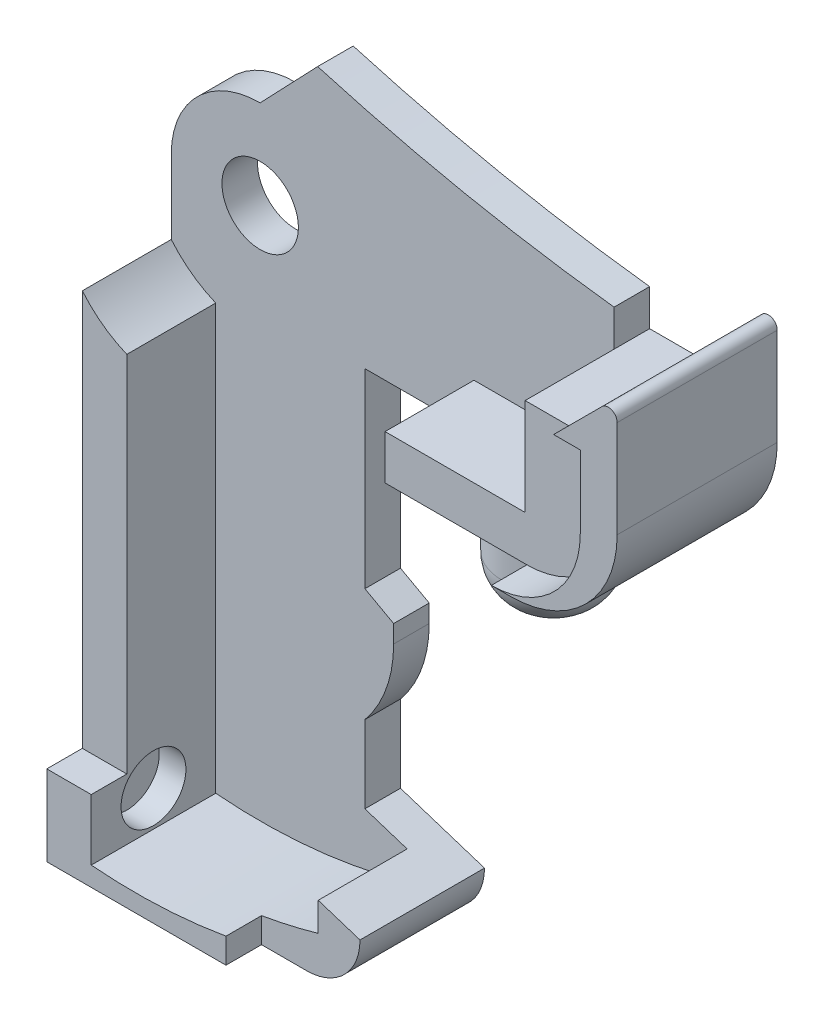
from build123d import *

# Parameters (mm, degrees)
EXTRUDE_3_DEPTH     = 9
EXTRUDE_3_2_DEPTH   = 9
EXTRUDE_4_DEPTH     = 7
SKETCH_1_8_R        = 2.15
EXTRUDE_5_DEPTH     = 2
SKETCH_2_R          = 2.9
EXTRUDE_6_DEPTH     = 2.45
SKETCH_4_R          = 2.9
EXTRUDE_7_DEPTH     = 2
FILLET_2_R          = 2.4
SKETCH_5_R          = 1.825
CUT_EXTRUDE_1_DEPTH = 1.5


with BuildPart() as part:
    # 스케치1 → 보스-돌출3 (new body)
    with BuildSketch(Plane.XY):
        with BuildLine():
            Line((-2.5, -26.437677825), (-5, -26.437677825))
            Line((-5, -26.437677825), (-5, -30.96175738))
            Line((-5, -30.96175738), (5.076141326, -30.96175738))
            Line((5.076141326, -30.96175738), (5.076141326, -29.54601506))
            ThreePointArc((5.076141326, -29.54601506), (1.298498135, -29.950761581), (-2.5, -29.874474333))
            Line((-2.5, -29.874474333), (-2.5, -26.437677825))
        make_face()
    extrude(amount=EXTRUDE_3_DEPTH)

    # 스케치1<7> → 보스-돌출4 (add)
    with BuildSketch(Plane.XY):
        with BuildLine():
            Line((23.5, 2.950728465), (19.9, 2.950728465))
            Line((19.9, 2.950728465), (19.9, -2.499271535))
            Line((19.9, -2.499271535), (12.023157318, -2.499271535))
            Line((12.023157318, -2.499271535), (12.023157318, -5))
            Line((12.023157318, -5), (20, -5))
            ThreePointArc((20, -5), (23.535533906, -3.535533906), (25, 0))
            Line((25, 0), (25, 4.09591659))
            Line((25, 4.09591659), (23.5, 4.09591659))
            Line((23.5, 4.09591659), (23.5, 2.950728465))
        make_face()
        with BuildLine():
            ThreePointArc((-2.5, -6), (-3.862002616, -5.228282299), (-5, -4.153311931))
            Line((-5, -4.153311931), (-5, -26.437677825))
            Line((-5, -26.437677825), (-2.5, -26.437677825))
            Line((-2.5, -26.437677825), (-2.5, -6))
        make_face()
        with BuildLine():
            Line((5.076141326, -29.54601506), (5.076141326, -30.96175738))
            Line((5.076141326, -30.96175738), (7.613716386, -30.96175738))
            ThreePointArc((7.613716386, -30.96175738), (9.735036729, -30.083077723), (10.613716386, -27.96175738))
            Line((10.613716386, -27.96175738), (8.264928228, -27.20398111))
            Line((8.264928228, -27.20398111), (8.264928228, -28.81709871))
            ThreePointArc((8.264928228, -28.81709871), (6.680483813, -29.225080884), (5.076141326, -29.54601506))
        make_face()
    extrude(amount=EXTRUDE_4_DEPTH)


with BuildPart() as body_2:
    # 스케치1 → Extrude 3 2 (new body)
    with BuildSketch(Plane.XY):
        with BuildLine():
            Line((26.22215467, 6.81807126), (23.5, 4.09591659))
            Line((23.5, 4.09591659), (25, 4.09591659))
            Line((25, 4.09591659), (25, 0))
            ThreePointArc((25, 0), (23.535533906, -3.535533906), (20, -5))
            Line((20, -5), (21.075708061, -5))
            ThreePointArc((21.075708061, -5), (25.318348748, -3.242640687), (27.075708061, 1))
            Line((27.075708061, 1), (27.075708061, 6.46451787))
            ThreePointArc((27.075708061, 6.46451787), (26.767049777, 6.926457636), (26.22215467, 6.81807126))
        make_face()
    extrude(amount=EXTRUDE_3_2_DEPTH)


with BuildPart() as extrude_4_piece_1:
    # of the separate pieces the step leaves, piece 1, a body of its own (extrude_4_pieces)
    add(part.part.solids().sort_by_distance((-2.5, -29.874474333, 0))[0])



with BuildPart() as extrude_4_piece_2:
    # of the separate pieces the step leaves, piece 2, a body of its own (extrude_4_pieces)
    add(part.part.solids().sort_by_distance((23.5, 2.950728465, 0))[0])


with BuildPart() as extrude_4_piece_1_1:
    add(extrude_4_piece_1.part)

    add(extrude_4_piece_2.part)  # 보스-돌출5 merges 보스-돌출4 piece 2
    # 스케치1<8> → 보스-돌출5 (add)
    with BuildSketch(Plane.XY):
        with BuildLine():
            Line((3.231912185, 8.38327913), (0, 5))
            ThreePointArc((0, 5), (-3.535533906, 3.535533906), (-5, 0))
            Line((-5, 0), (-5, -4.153311931))
            ThreePointArc((-5, -4.153311931), (-3.862002616, -5.228282299), (-2.5, -6))
            Line((-2.5, -6), (-2.5, -29.874474333))
            ThreePointArc((-2.5, -29.874474333), (2.93054776, -29.83531643), (8.264928228, -28.81709871))
            Line((8.264928228, -28.81709871), (8.264928228, -27.20398111))
            Line((8.264928228, -27.20398111), (5.889404941, -26.437579436))
            Line((5.889404941, -26.437579436), (5.889404941, -22.090836604))
            ThreePointArc((5.889404941, -22.090836604), (7.089676261, -19.98856225), (7.506209453, -17.603880133))
            Line((7.506209453, -17.603880133), (7.506209453, -16.606122356))
            Line((7.506209453, -16.606122356), (5.889404941, -15.718789718))
            Line((5.889404941, -15.718789718), (5.889404941, -5))
            Line((5.889404941, -5), (12.023157318, -5))
            Line((12.023157318, -5), (12.023157318, -2.499271535))
            Line((12.023157318, -2.499271535), (19.9, -2.499271535))
            Line((19.9, -2.499271535), (19.9, 5))
            ThreePointArc((19.9, 5), (11.496170313, 6.34783243), (3.231912185, 8.38327913))
        make_face()
        Circle(SKETCH_1_8_R, mode=Mode.SUBTRACT)
    extrude(amount=EXTRUDE_5_DEPTH)

    # 스케치2 → 보스-돌출6 (add, symmetric)
    with BuildSketch(Plane.XZ.offset(5)):
        with Locations((18, 3.5)):
            Circle(SKETCH_2_R)
    extrude(amount=EXTRUDE_6_DEPTH, both=True)

    # 스케치4 → 보스-돌출7 (add)
    with BuildSketch(Plane.XZ.offset(7.45)):
        with Locations((18, 3.5)):
            Circle(SKETCH_4_R)
    extrude(amount=EXTRUDE_7_DEPTH)

    # 필렛2
    fillet_2_edges = [extrude_4_piece_1_1.edges().sort_by_distance(p)[0] for p in [
        (15.1, -9.45, 3.5),
    ]]
    fillet(fillet_2_edges, radius=FILLET_2_R)

    # 스케치5 → 컷-돌출1 (cut)
    with BuildSketch(Plane(origin=(-2.5, 0, 0), x_dir=(0, 0, -1), z_dir=(1, 0, 0))):
        with Locations((-5.5, -27.874474333)):
            Circle(SKETCH_5_R)
    extrude(amount=-CUT_EXTRUDE_1_DEPTH, mode=Mode.SUBTRACT)


solid = Compound([body_2.part, extrude_4_piece_1_1.part])
